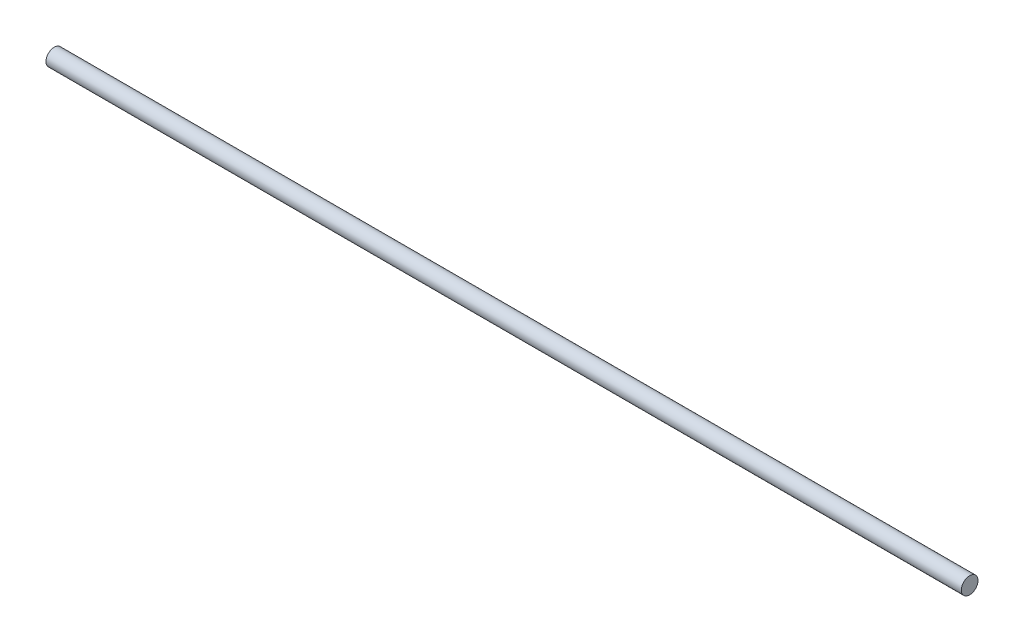
from build123d import *

# Parameters (mm, degrees)
SKETCH_1_R      = 2
EXTRUDE_1_DEPTH = 110


with BuildPart() as part:
    # 草图1 → 凸台-拉伸1 (new, symmetric)
    with BuildSketch(Plane(origin=(0, 0, 0), x_dir=(0, 0, -1), z_dir=(1, 0, 0))):
        Circle(SKETCH_1_R)
    extrude(amount=EXTRUDE_1_DEPTH, both=True)


solid = part.part
